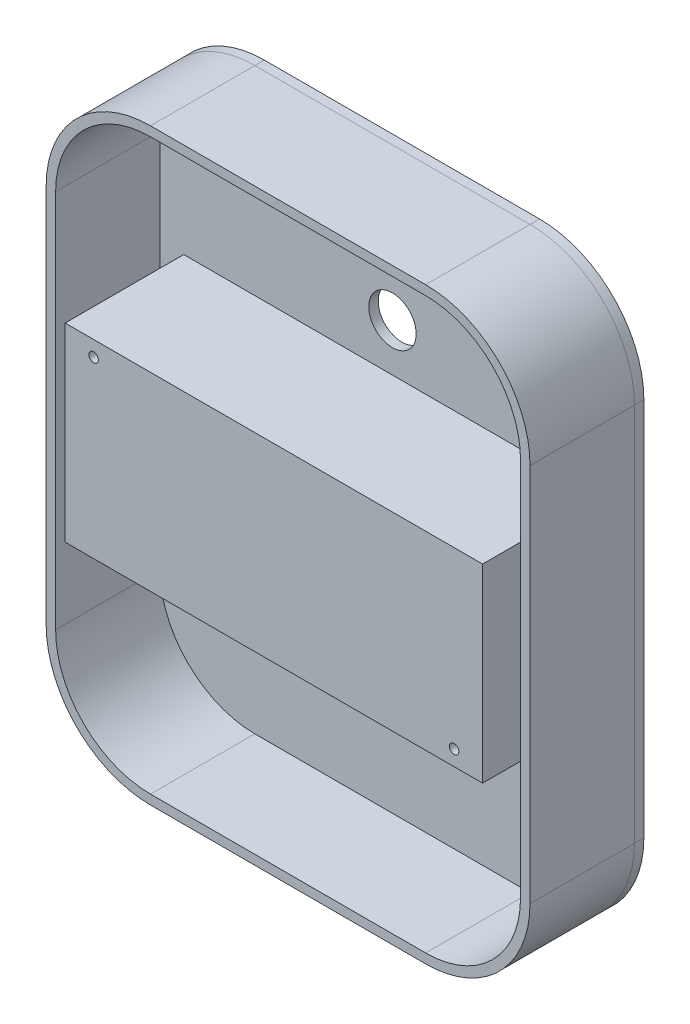
from build123d import *

# Parameters (mm, degrees)
BOSS_EXTRUDE1_DEPTH = 22
SKETCH3_W           = 88
SKETCH3_H           = 40
SKETCH3_R           = 1
BOSS_EXTRUDE2_DEPTH = 25
BOSS_EXTRUDE3_START = -2
SKETCH6_R           = 1.75
SKETCH6_R_2         = 5
BOSS_EXTRUDE3_DEPTH = 2


with BuildPart() as part:
    # Sketch1 → Boss-Extrude1 (new body)
    with BuildSketch(Plane.XY):
        with BuildLine():
            Line((-29, 62), (29, 62))
            ThreePointArc((29, 62), (44.556349186, 55.556349186), (51, 40))
            Line((51, 40), (51, -40))
            ThreePointArc((51, -40), (44.556349186, -55.556349186), (29, -62))
            Line((29, -62), (-29, -62))
            ThreePointArc((-29, -62), (-44.556349186, -55.556349186), (-51, -40))
            Line((-51, -40), (-51, 40))
            ThreePointArc((-51, 40), (-44.556349186, 55.556349186), (-29, 62))
        make_face()
        with BuildLine():
            Line((-29, 60), (29, 60))
            ThreePointArc((29, 60), (43.142135624, 54.142135624), (49, 40))
            Line((49, 40), (49, -40))
            ThreePointArc((49, -40), (43.142135624, -54.142135624), (29, -60))
            Line((29, -60), (-29, -60))
            ThreePointArc((-29, -60), (-43.142135624, -54.142135624), (-49, -40))
            Line((-49, -40), (-49, 40))
            ThreePointArc((-49, 40), (-43.142135624, 54.142135624), (-29, 60))
        make_face(mode=Mode.SUBTRACT)
    extrude(amount=BOSS_EXTRUDE1_DEPTH)


with BuildPart() as body_2:
    # Sketch3 → Boss-Extrude2 (new body)
    with BuildSketch(Plane.XY):
        Rectangle(SKETCH3_W, SKETCH3_H)
        with Locations((-38, 16.75)):
            Circle(SKETCH3_R, mode=Mode.SUBTRACT)
        with Locations((38, -16.75)):
            Circle(SKETCH3_R, mode=Mode.SUBTRACT)
    extrude(amount=BOSS_EXTRUDE2_DEPTH)

    # Sketch6 → Boss-Extrude3 (add)
    with BuildSketch(Plane.XY.offset(BOSS_EXTRUDE3_START)):
        with BuildLine():
            Line((-29, 62), (29, 62))
            ThreePointArc((29, 62), (44.556349186, 55.556349186), (51, 40))
            Line((51, 40), (51, -40))
            ThreePointArc((51, -40), (44.556349186, -55.556349186), (29, -62))
            Line((29, -62), (-29, -62))
            ThreePointArc((-29, -62), (-44.556349186, -55.556349186), (-51, -40))
            Line((-51, -40), (-51, 40))
            ThreePointArc((-51, 40), (-44.556349186, 55.556349186), (-29, 62))
        make_face()
        with Locations((0, 41)):
            Circle(SKETCH6_R, mode=Mode.SUBTRACT)
        with Locations((0, -41)):
            Circle(SKETCH6_R, mode=Mode.SUBTRACT)
        with Locations((0, 30)):
            Circle(SKETCH6_R_2, mode=Mode.SUBTRACT)
        with Locations((0, -30)):
            Circle(SKETCH6_R_2, mode=Mode.SUBTRACT)
    extrude(amount=BOSS_EXTRUDE3_DEPTH)


solid = Compound([part.part, body_2.part])
